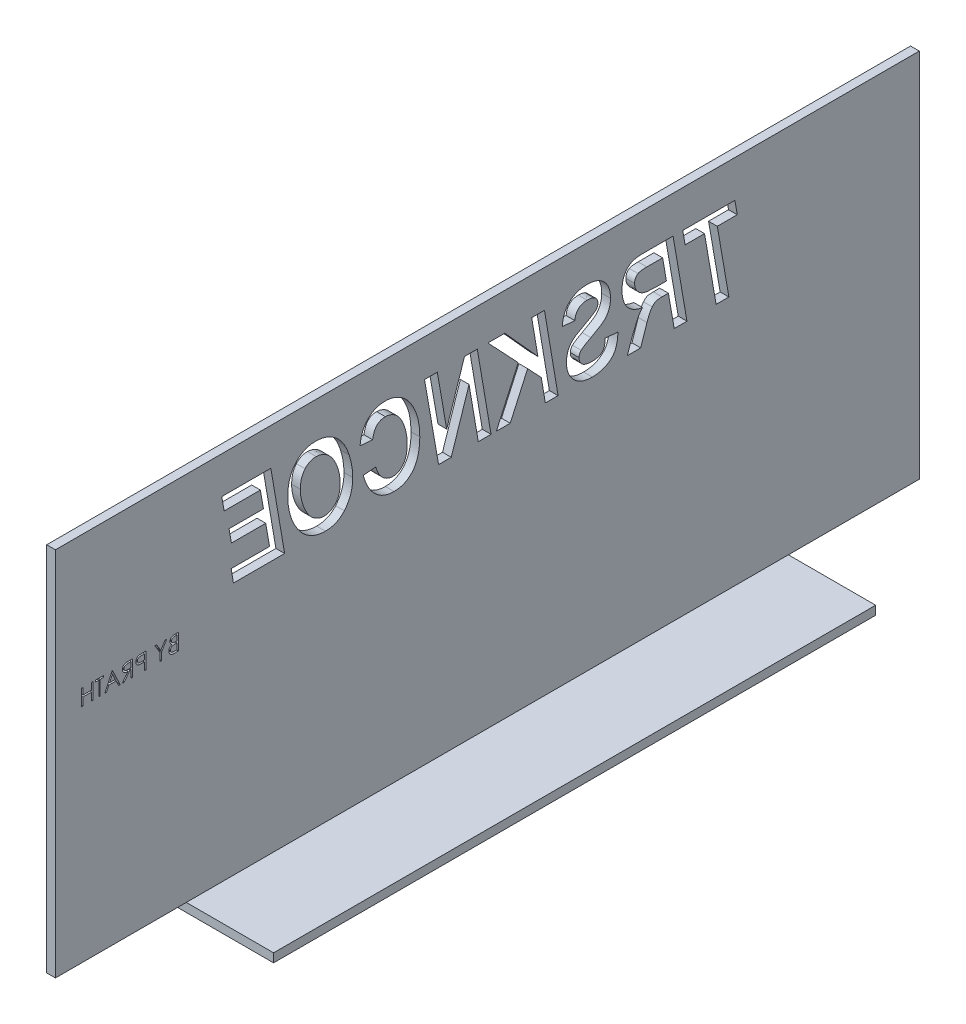
from build123d import *

# Parameters (mm, degrees)
BOSS_EXTRUDE1_DEPTH = 198
SKETCH2_W           = 22
SKETCH2_H           = 30
CUT_EXTRUDE3_DEPTH  = 2
CUT_EXTRUDE4_DEPTH  = 22


with BuildPart() as part:
    # Sketch1 → Boss-Extrude1 (new body)
    with BuildSketch(Plane.XY):
        Polygon((-48.621399177, 40.138888889), (-48.621399177, -44.861111111), (-28.621399177, -44.861111111), (-28.621399177, -46.861111111), (-50.621399177, -46.861111111), (-50.621399177, 40.138888889), align=None)
    extrude(amount=BOSS_EXTRUDE1_DEPTH)

    # Sketch2 → Cut-Extrude3 (cut)
    with BuildSketch(Plane(origin=(0, -46.861111111, 0), x_dir=(-1, 0, 0), z_dir=(0, -1, 0))):
        with Locations((39.621399177, -15)):
            Rectangle(SKETCH2_W, SKETCH2_H)
        with Locations((39.621399177, -183)):
            Rectangle(SKETCH2_W, SKETCH2_H)
    extrude(amount=-CUT_EXTRUDE3_DEPTH, mode=Mode.SUBTRACT)

    # Sketch3 → Cut-Extrude4 (cut)
    # profile 1 of 15: a face of its own
    with BuildSketch(Plane.ZY.offset(50.621399177)):
        Polygon((46.567523887, 13.138888889), (43.644393643, 13.138888889), (46.297350103, 28.508775253), (41.723157848, 28.508775253), (42.256000588, 31.63078342), (54.211190518, 31.63078342), (53.678347778, 28.508775253), (49.22423276, 28.508775253), align=None)
    # profile 2 of 15: a face of its own
    with BuildSketch(Plane.ZY.offset(50.621399177)):
        with BuildLine():
            Line((56.173702864, 13.138888889), (53.250572621, 13.138888889))
            Line((53.250572621, 13.138888889), (56.436371821, 31.63078342))
            Line((56.436371821, 31.63078342), (63.175706759, 31.63078342))
            add(Edge.make_bspline(
                [(63.175706759, 31.63078342), (63.329568599, 31.629289792), (63.627461628, 31.626397967), (64.05967934, 31.605745592), (64.46099239, 31.561928029), (64.834015106, 31.513515612), (65.174971689, 31.439375874), (65.487847202, 31.361116755), (65.768077197, 31.257486066), (66.103348884, 31.103746737), (66.485014679, 30.860869974), (66.89247786, 30.492917073), (67.253444104, 30.049007568), (67.568490048, 29.53226492), (67.831332978, 28.943034026), (68.011561018, 28.274984778), (68.119954124, 27.535454012), (68.133234947, 27.018211967), (68.140150036, 26.748893245)],
                knots=[0, 0, 0, 0, 0.919049624, 1.779378665, 2.58298458, 3.329968567, 4.02448668, 4.665989489, 5.254490669, 5.806027726, 6.867219757, 7.941194704, 9.071879607, 10.272474829, 11.54685954, 12.911757218, 14.392006979, 16, 16, 16, 16], degree=3))
            add(Edge.make_bspline(
                [(68.140150036, 26.748893245), (68.136537642, 26.548656377), (68.129456029, 26.156118873), (68.074415433, 25.582371689), (67.974591163, 25.040109892), (67.846419447, 24.526396129), (67.672159153, 24.04651755), (67.465307365, 23.594276211), (67.218139489, 23.173839662), (66.930193088, 22.786224998), (66.612325354, 22.428137368), (66.257373711, 22.107477985), (65.867730413, 21.824891536), (65.446093652, 21.577635154), (64.992069296, 21.3615867), (64.504560968, 21.183190133), (63.983970903, 21.038173694), (63.62291543, 20.975792879), (63.438375716, 20.943909308)],
                knots=[0, 0, 0, 0, 1.163404323, 2.280698027, 3.344173194, 4.364791145, 5.353309187, 6.306074943, 7.250879738, 8.181177463, 9.107634786, 10.028688646, 10.954689755, 11.899494549, 12.865009021, 13.872160013, 14.912435868, 16, 16, 16, 16], degree=3))
            add(Edge.make_bspline(
                [(63.438375716, 20.943909308), (63.545975342, 20.823344708), (63.773159455, 20.568786559), (64.078897539, 20.123598778), (64.394082408, 19.618199673), (64.582050767, 19.246974672), (64.680424638, 19.052692822)],
                knots=[0, 0, 0, 0, 0.853378181, 1.801808913, 2.849569315, 4, 4, 4, 4], degree=3))
            add(Edge.make_bspline(
                [(64.680424638, 19.052692822), (64.76637563, 18.865470321), (64.945386027, 18.475541441), (65.205959294, 17.860321923), (65.475859942, 17.195968335), (65.754905128, 16.48263916), (66.03419848, 15.717035426), (66.322973568, 14.902676433), (66.621122576, 14.039293698), (66.814033384, 13.444414097), (66.913110768, 13.138888889)],
                knots=[0, 0, 0, 0, 0.781664242, 1.627974532, 2.534890683, 3.502644135, 4.534224147, 5.627060285, 6.78127793, 8, 8, 8, 8], degree=3))
            Line((66.913110768, 13.138888889), (63.851141219, 13.138888889))
            add(Edge.make_bspline(
                [(63.851141219, 13.138888889), (63.829007535, 13.219051544), (63.776228743, 13.410203104), (63.673793891, 13.737263346), (63.541786837, 14.151053735), (63.381876956, 14.649779117), (63.183728546, 15.23249208), (62.960532937, 15.902323453), (62.70500506, 16.658120421), (62.521839138, 17.189097884), (62.425224027, 17.469174256)],
                knots=[0, 0, 0, 0, 0.437720385, 1.043764505, 1.8037744, 2.724066494, 3.800474684, 5.043444489, 6.440496257, 8, 8, 8, 8], degree=3))
            add(Edge.make_bspline(
                [(62.425224027, 17.469174256), (62.373087492, 17.614404475), (62.272526228, 17.894525399), (62.121064892, 18.296412028), (61.963982628, 18.661129509), (61.818993873, 18.994554336), (61.664799506, 19.28863695), (61.522093883, 19.551908405), (61.375438356, 19.778208339), (61.272764772, 19.912564983), (61.224451655, 19.975786583)],
                knots=[0, 0, 0, 0, 1.326924511, 2.559380028, 3.692053328, 4.741547842, 5.684376052, 6.546242998, 7.315933767, 8, 8, 8, 8], degree=3))
            add(Edge.make_bspline(
                [(61.224451655, 19.975786583), (61.156961959, 20.052040858), (61.027839637, 20.197931707), (60.821529444, 20.388708586), (60.609631386, 20.535522026), (60.387440629, 20.654268132), (60.124207794, 20.733642566), (59.801705086, 20.786617657), (59.40766413, 20.818678542), (59.120664537, 20.822023581), (58.965498629, 20.823832071)],
                knots=[0, 0, 0, 0, 0.968941115, 1.853793008, 2.666169901, 3.416897252, 4.241394675, 5.268896448, 6.523432879, 8, 8, 8, 8], degree=3))
            Line((58.965498629, 20.823832071), (57.502057301, 20.823832071))
            Line((57.502057301, 20.823832071), (56.173702864, 13.138888889))
        make_face()
        with BuildLine():
            Line((57.956099354, 23.465531289), (59.791029635, 23.465531289))
            add(Edge.make_bspline(
                [(59.791029635, 23.465531289), (59.992425568, 23.46576246), (60.377769258, 23.466204773), (60.930640589, 23.482914257), (61.432554555, 23.502738334), (61.884055779, 23.537962448), (62.285061642, 23.576249986), (62.634107427, 23.62947697), (62.933303116, 23.686793127), (63.260600485, 23.781048559), (63.624640813, 23.933268627), (64.013662689, 24.187004604), (64.371296639, 24.495753788), (64.67751844, 24.86763635), (64.937936157, 25.274662584), (65.122994249, 25.714943406), (65.236655308, 26.17655604), (65.251026235, 26.491834359), (65.258296342, 26.651330489)],
                knots=[0, 0, 0, 0, 1.341655905, 2.567075869, 3.684830852, 4.687612021, 5.583953662, 6.367664427, 7.039345834, 7.611667031, 8.634740313, 9.654141779, 10.693611133, 11.770163255, 12.852216315, 13.901559162, 14.938419889, 16, 16, 16, 16], degree=3))
            add(Edge.make_bspline(
                [(65.258296342, 26.651330489), (65.256641604, 26.737788181), (65.253458545, 26.904098332), (65.214756844, 27.144801083), (65.151157795, 27.366364836), (65.064562485, 27.570741387), (64.954491948, 27.759255047), (64.815718116, 27.926853023), (64.651369064, 28.075517768), (64.528894914, 28.158716568), (64.466537059, 28.201077332)],
                knots=[0, 0, 0, 0, 1.135910358, 2.185038931, 3.194885851, 4.160224032, 5.096688654, 6.054854728, 7.00962705, 8, 8, 8, 8], degree=3))
            add(Edge.make_bspline(
                [(64.466537059, 28.201077332), (64.423359009, 28.226080962), (64.328026299, 28.281286415), (64.159012077, 28.341508381), (63.956629365, 28.393322708), (63.721366555, 28.439537094), (63.449803142, 28.464629014), (63.146212094, 28.49369241), (62.808092626, 28.507469455), (62.57157401, 28.508326516), (62.447738509, 28.508775253)],
                knots=[0, 0, 0, 0, 0.579564179, 1.279618308, 2.077378172, 3.010695435, 4.064953319, 5.248132921, 6.559188078, 8, 8, 8, 8], degree=3))
            Line((62.447738509, 28.508775253), (58.82290691, 28.508775253))
            Line((58.82290691, 28.508775253), (57.956099354, 23.465531289))
        make_face(mode=Mode.SUBTRACT)
    # profile 3 of 15: a face of its own
    with BuildSketch(Plane.ZY.offset(50.621399177)):
        with BuildLine():
            Line((69.100767933, 18.902596275), (71.982621626, 19.14275075))
            add(Edge.make_bspline(
                [(71.982621626, 19.14275075), (71.994287599, 18.927296487), (72.015790273, 18.530172046), (72.092163388, 17.988920895), (72.18110205, 17.549707672), (72.310906676, 17.203011485), (72.486566383, 16.928577444), (72.703942056, 16.699044963), (72.964715439, 16.496943549), (73.272093823, 16.323277805), (73.633947543, 16.182739032), (74.053890772, 16.090130033), (74.531186143, 16.028444492), (74.869250874, 16.02340977), (75.048343589, 16.020742582)],
                knots=[0, 0, 0, 0, 1.520410831, 2.80241521, 3.850701541, 4.674385914, 5.396022026, 6.132219796, 6.892476354, 7.713891879, 8.61291211, 9.618221336, 10.738232148, 12, 12, 12, 12], degree=3))
            add(Edge.make_bspline(
                [(75.048343589, 16.020742582), (75.165943361, 16.023558392), (75.395174623, 16.029047106), (75.727821418, 16.052532699), (76.038547628, 16.102863427), (76.32614662, 16.168891959), (76.592421129, 16.254170005), (76.831868646, 16.365003815), (77.053648651, 16.48727039), (77.3083446, 16.681437969), (77.581742134, 16.959192755), (77.817265526, 17.35278757), (77.964734424, 17.79547941), (77.97906635, 18.107144002), (77.986483487, 18.268438366)],
                knots=[0, 0, 0, 0, 1.013540598, 1.975643205, 2.87038221, 3.722572232, 4.516630097, 5.273853093, 5.993001592, 6.693497475, 8.027261769, 9.322862643, 10.614513231, 12, 12, 12, 12], degree=3))
            add(Edge.make_bspline(
                [(77.986483487, 18.268438366), (77.980924699, 18.382886523), (77.969991362, 18.60798961), (77.876763151, 18.932682135), (77.721409213, 19.232407182), (77.573721328, 19.401860495), (77.498669711, 19.487972807)],
                knots=[0, 0, 0, 0, 1.018283683, 2.002817762, 2.985077502, 4, 4, 4, 4], degree=3))
            add(Edge.make_bspline(
                [(77.498669711, 19.487972807), (77.451794443, 19.532500916), (77.349371068, 19.629795703), (77.167209423, 19.770809897), (76.948201845, 19.924239304), (76.691855559, 20.093421164), (76.397130009, 20.278045974), (76.058021529, 20.465381816), (75.685679304, 20.674750168), (75.422651785, 20.8144028), (75.28474565, 20.887623103)],
                knots=[0, 0, 0, 0, 0.590480477, 1.290211368, 2.102035284, 3.034021357, 4.096544472, 5.278887346, 6.573312291, 8, 8, 8, 8], degree=3))
            add(Edge.make_bspline(
                [(75.28474565, 20.887623103), (75.109331982, 20.980876723), (74.772256198, 21.160073347), (74.293520578, 21.425968892), (73.859427622, 21.67486472), (73.469491482, 21.906139883), (73.123922713, 22.123511097), (72.822884324, 22.325316465), (72.56812018, 22.512684261), (72.286855412, 22.73605222), (71.985637141, 23.026780966), (71.679233733, 23.413945659), (71.405237536, 23.831037047), (71.180453416, 24.288961278), (70.99966633, 24.780190513), (70.872466182, 25.306390749), (70.796952422, 25.864872936), (70.786968452, 26.248332171), (70.781849254, 26.444947738)],
                knots=[0, 0, 0, 0, 1.246546927, 2.395370823, 3.436045129, 4.3863436, 5.23993239, 5.997476255, 6.659929147, 7.22377446, 8.250624136, 9.277803704, 10.316226236, 11.376254308, 12.471269764, 13.594389891, 14.766543215, 16, 16, 16, 16], degree=3))
            add(Edge.make_bspline(
                [(70.781849254, 26.444947738), (70.785923916, 26.646526649), (70.793869655, 27.039612913), (70.862987197, 27.613397311), (70.974788204, 28.156057143), (71.131330228, 28.668317859), (71.336400935, 29.147329983), (71.580060077, 29.598559864), (71.87422008, 30.016006771), (72.2128072, 30.398294567), (72.587473139, 30.744583153), (72.999186704, 31.046470047), (73.444820218, 31.30278229), (73.922664225, 31.513183989), (74.433322053, 31.67601402), (74.977213356, 31.784809124), (75.551574481, 31.860121223), (75.946164932, 31.867279839), (76.147800792, 31.870937895)],
                knots=[0, 0, 0, 0, 1.121247003, 2.186472748, 3.210148776, 4.200738383, 5.161165769, 6.104830393, 7.04898248, 7.995670446, 8.941334633, 9.882300828, 10.830113673, 11.796072362, 12.782104355, 13.805780383, 14.878752997, 16, 16, 16, 16], degree=3))
            add(Edge.make_bspline(
                [(76.147800792, 31.870937895), (76.351876182, 31.866820905), (76.751182926, 31.858765343), (77.334919704, 31.789719846), (77.887657569, 31.678418507), (78.410287564, 31.521369374), (78.89798677, 31.313296774), (79.357914913, 31.065526541), (79.781633132, 30.766040214), (80.17713861, 30.429084905), (80.534804822, 30.050171286), (80.846860967, 29.628625257), (81.122961548, 29.174193879), (81.352189625, 28.679330921), (81.534617909, 28.147969056), (81.677590517, 27.580697602), (81.779199548, 26.97699665), (81.812123367, 26.560375215), (81.828955078, 26.347384983)],
                knots=[0, 0, 0, 0, 1.101317662, 2.154907414, 3.167906546, 4.141877806, 5.094959521, 6.025581883, 6.956522612, 7.890274933, 8.826489602, 9.762314628, 10.716471989, 11.692173592, 12.700051806, 13.744842569, 14.847091228, 16, 16, 16, 16], degree=3))
            Line((81.828955078, 26.347384983), (78.947101385, 26.107230508))
            add(Edge.make_bspline(
                [(78.947101385, 26.107230508), (78.922579595, 26.314906404), (78.876029567, 26.709140215), (78.704888717, 27.253696326), (78.46509659, 27.719954176), (78.142594897, 28.102210955), (77.74205921, 28.396828866), (77.269322607, 28.603800486), (76.725813308, 28.728875296), (76.339891873, 28.742009238), (76.136543551, 28.748929727)],
                knots=[0, 0, 0, 0, 1.155090298, 2.192722699, 3.140166295, 4.038822298, 4.934487934, 5.867075245, 6.876127035, 8, 8, 8, 8], degree=3))
            add(Edge.make_bspline(
                [(76.136543551, 28.748929727), (75.937235822, 28.744380915), (75.564813652, 28.735881103), (75.046635068, 28.643395544), (74.610420584, 28.489354377), (74.256775794, 28.267818795), (73.988497648, 27.988738064), (73.798972556, 27.661606581), (73.682705429, 27.289430731), (73.670193748, 27.024943197), (73.663702947, 26.88773255)],
                knots=[0, 0, 0, 0, 1.360316716, 2.541858782, 3.579953702, 4.502023153, 5.36621562, 6.197157373, 7.064722641, 8, 8, 8, 8], degree=3))
            add(Edge.make_bspline(
                [(73.663702947, 26.88773255), (73.670910388, 26.760217804), (73.68491821, 26.512390044), (73.817175279, 26.161067634), (74.031807725, 25.849345464), (74.227181743, 25.68523792), (74.327880166, 25.600654664)],
                knots=[0, 0, 0, 0, 1.014279531, 1.971274952, 2.954367562, 4, 4, 4, 4], degree=3))
            add(Edge.make_bspline(
                [(74.327880166, 25.600654664), (74.386236973, 25.556272411), (74.511988226, 25.460634486), (74.722171643, 25.321492045), (74.959416079, 25.16498432), (75.231361693, 25.001335563), (75.531716645, 24.821819003), (75.865816804, 24.634046563), (76.22692857, 24.430915468), (76.481432355, 24.296705101), (76.613100087, 24.227271263)],
                knots=[0, 0, 0, 0, 0.659164579, 1.420413089, 2.265921517, 3.215069028, 4.274159563, 5.412647679, 6.661431262, 8, 8, 8, 8], degree=3))
            add(Edge.make_bspline(
                [(76.613100087, 24.227271263), (76.786281615, 24.137013391), (77.11838684, 23.963928471), (77.586066347, 23.698835379), (78.01160059, 23.456222355), (78.39095459, 23.22762731), (78.723533891, 23.014555119), (79.012332617, 22.819845868), (79.251120894, 22.6374997), (79.509078992, 22.415952803), (79.783793087, 22.131531854), (80.067369865, 21.757437968), (80.306751586, 21.345181622), (80.510671952, 20.900846219), (80.671637582, 20.42302256), (80.788642697, 19.912977809), (80.855707462, 19.372200877), (80.864070825, 19.00159398), (80.86833718, 18.812538347)],
                knots=[0, 0, 0, 0, 1.270262823, 2.435946395, 3.496632551, 4.456673833, 5.316608941, 6.065876655, 6.72171307, 7.269767235, 8.276759071, 9.287327571, 10.315785927, 11.371655164, 12.462617561, 13.589636757, 14.770414822, 16, 16, 16, 16], degree=3))
            add(Edge.make_bspline(
                [(80.86833718, 18.812538347), (80.863133288, 18.599696268), (80.852936974, 18.182661391), (80.777659077, 17.571823761), (80.649013377, 16.992015352), (80.475033581, 16.439198058), (80.238395848, 15.921474674), (79.961278853, 15.428738402), (79.628185491, 14.968847857), (79.246644403, 14.543161297), (78.824780688, 14.157635023), (78.366749497, 13.82082131), (77.877754759, 13.534807975), (77.354903892, 13.299573251), (76.798271088, 13.120439783), (76.208577216, 12.994359235), (75.588461261, 12.912811944), (75.163680049, 12.903489269), (74.94702842, 12.898734414)],
                knots=[0, 0, 0, 0, 1.085260672, 2.126419521, 3.132360815, 4.110683442, 5.075669868, 6.029801971, 6.989291782, 7.96501179, 8.940273018, 9.898362516, 10.858869454, 11.82385588, 12.816278689, 13.834680673, 14.895619805, 16, 16, 16, 16], degree=3))
            add(Edge.make_bspline(
                [(74.94702842, 12.898734414), (74.781807926, 12.900046985), (74.45831797, 12.902616904), (73.982629374, 12.947840617), (73.524885469, 13.00906302), (73.084851743, 13.099424259), (72.663448289, 13.215514256), (72.260781602, 13.35823361), (71.876788982, 13.527259108), (71.513345514, 13.722297994), (71.173605249, 13.938412105), (70.861093637, 14.172861114), (70.571909066, 14.419324694), (70.318480325, 14.691970214), (70.087639248, 14.976233039), (69.887872011, 15.279700832), (69.713339225, 15.598802271), (69.526935527, 16.050849905), (69.343333941, 16.640854591), (69.191176401, 17.372273609), (69.099723195, 18.12974211), (69.100415897, 18.642174066), (69.100767933, 18.902596275)],
                knots=[0, 0, 0, 0, 1.033089426, 2.022715487, 2.986516948, 3.921035096, 4.830318251, 5.718759763, 6.591067943, 7.45221577, 8.296564001, 9.107174858, 9.894763495, 10.669657106, 11.432166275, 12.183024751, 12.93924541, 13.703639053, 15.237902801, 16.797024157, 18.372220865, 20, 20, 20, 20], degree=3))
        make_face()
    # profile 4 of 15: a face of its own
    with BuildSketch(Plane.ZY.offset(50.621399177)):
        Polygon((82.789572976, 13.138888889), (85.911581143, 31.63078342), (88.838463801, 31.63078342), (87.416299022, 23.229129229), (95.007431863, 31.63078342), (98.879922763, 31.63078342), (91.926700245, 24.261042986), (96.939924899, 13.138888889), (93.757878113, 13.138888889), (89.769062389, 21.979575479), (86.643301808, 18.662441801), (85.712703219, 13.138888889), align=None)
    # profile 5 of 15: a face of its own
    with BuildSketch(Plane.ZY.offset(50.621399177)):
        Polygon((110.178440302, 13.138888889), (107.277824541, 13.138888889), (103.195198475, 25.563130527), (101.078837169, 13.138888889), (98.159459339, 13.138888889), (101.311486816, 31.63078342), (104.238369474, 31.63078342), (108.320995539, 19.25532316), (110.474880981, 31.63078342), (113.405516052, 31.63078342), align=None)
    # profile 6 of 15: a face of its own
    with BuildSketch(Plane.ZY.offset(50.621399177)):
        with BuildLine():
            Line((124.576451527, 19.863214173), (127.45830522, 19.623059699))
            add(Edge.make_bspline(
                [(127.45830522, 19.623059699), (127.377106464, 19.350809264), (127.218320396, 18.818417175), (126.942123434, 18.05292135), (126.633146306, 17.34205914), (126.300634067, 16.682160847), (125.935656806, 16.077207727), (125.545775615, 15.521894808), (125.12442503, 15.021644817), (124.677335596, 14.573576547), (124.207157952, 14.178903218), (123.719135256, 13.834338678), (123.2082518, 13.548989068), (122.681866247, 13.310215436), (122.136062706, 13.126399704), (121.572120798, 12.994230843), (120.990233629, 12.913627685), (120.595394894, 12.90372747), (120.396262706, 12.898734414)],
                knots=[0, 0, 0, 0, 1.293727053, 2.529913503, 3.703523175, 4.821930671, 5.89266624, 6.918437208, 7.908929347, 8.867606484, 9.797555239, 10.701510419, 11.584031482, 12.458574122, 13.330459673, 14.202345223, 15.093374342, 16, 16, 16, 16], degree=3))
            add(Edge.make_bspline(
                [(120.396262706, 12.898734414), (120.174484086, 12.903776192), (119.741340822, 12.913623003), (119.110381694, 13.011724676), (118.513569852, 13.162108174), (117.955364277, 13.38416485), (117.42683794, 13.65742294), (116.938376248, 14.002050534), (116.485792781, 14.407798382), (116.066166442, 14.869892811), (115.694843273, 15.398610652), (115.370540478, 15.988798553), (115.097471885, 16.642104429), (114.873499612, 17.355621953), (114.702106498, 18.130511981), (114.580306132, 18.965727429), (114.504692877, 19.863078342), (114.494973258, 20.482207767), (114.489963601, 20.801317589)],
                knots=[0, 0, 0, 0, 0.952434383, 1.860145653, 2.737604016, 3.592088319, 4.436058528, 5.28907053, 6.153322799, 7.043937438, 7.965658913, 8.923221959, 9.932585217, 11.003645484, 12.133024564, 13.339497442, 14.628731794, 16, 16, 16, 16], degree=3))
            add(Edge.make_bspline(
                [(114.489963601, 20.801317589), (114.493793781, 21.080326707), (114.501340762, 21.630085824), (114.554244784, 22.441617418), (114.643184359, 23.227053255), (114.77239313, 23.986783927), (114.931386397, 24.722913213), (115.131856757, 25.432527655), (115.362856171, 26.117770301), (115.633860127, 26.771411885), (115.929467785, 27.393883769), (116.246517061, 27.978411833), (116.586548979, 28.521101616), (116.940867395, 29.024415367), (117.317401998, 29.485643713), (117.717378081, 29.902089974), (118.131748796, 30.283504328), (118.570374257, 30.616852404), (119.019558131, 30.914399821), (119.481666452, 31.169623451), (119.953511143, 31.385130975), (120.433217672, 31.560103954), (120.92129446, 31.703000164), (121.420347742, 31.797377189), (121.928086852, 31.86138246), (122.269769523, 31.867743847), (122.441328153, 31.870937895)],
                knots=[0, 0, 0, 0, 1.326081857, 2.612909553, 3.863592758, 5.081387437, 6.274331785, 7.441291427, 8.584352171, 9.709351928, 10.802289631, 11.858454482, 12.867995201, 13.844524669, 14.782338058, 15.694803285, 16.586998335, 17.456218336, 18.310343858, 19.145894667, 19.962643095, 20.773288765, 21.571123956, 22.37678395, 23.184984359, 24, 24, 24, 24], degree=3))
            add(Edge.make_bspline(
                [(122.441328153, 31.870937895), (122.633001589, 31.867556863), (123.00914544, 31.860921858), (123.559933502, 31.780701918), (124.089062577, 31.664004711), (124.591236014, 31.489907471), (125.069169369, 31.27059886), (125.52289961, 31.002832014), (125.949746729, 30.682228841), (126.352506919, 30.317424013), (126.724160659, 29.9094089), (127.056826028, 29.455732718), (127.344512192, 28.958910184), (127.593566929, 28.4210887), (127.803371635, 27.842429327), (127.971265385, 27.22099235), (128.099143286, 26.558545937), (128.151784123, 26.101410724), (128.178768643, 25.867076034)],
                knots=[0, 0, 0, 0, 0.996424594, 1.955403901, 2.889960847, 3.811926292, 4.71458142, 5.621939309, 6.547320429, 7.487164165, 8.445392458, 9.413775902, 10.408243551, 11.427256147, 12.493625461, 13.606592377, 14.77310166, 16, 16, 16, 16], degree=3))
            Line((128.178768643, 25.867076034), (125.29691495, 25.626921559))
            add(Edge.make_bspline(
                [(125.29691495, 25.626921559), (125.273433228, 25.764805546), (125.228148124, 26.030718358), (125.137632877, 26.41162901), (125.032503818, 26.759490777), (124.918345781, 27.078810111), (124.781330069, 27.363095541), (124.636763641, 27.622203249), (124.471663912, 27.846643251), (124.235622845, 28.10335923), (123.899838332, 28.365476485), (123.438949367, 28.591392604), (122.921505154, 28.724826981), (122.558454455, 28.740694523), (122.370032293, 28.748929727)],
                knots=[0, 0, 0, 0, 1.059068388, 2.042440618, 2.962453515, 3.810607956, 4.60720763, 5.349764878, 6.054566734, 6.711530681, 7.986817897, 9.253492024, 10.574571061, 12, 12, 12, 12], degree=3))
            add(Edge.make_bspline(
                [(122.370032293, 28.748929727), (122.170044531, 28.739089523), (121.767309243, 28.719273324), (121.173827312, 28.546757856), (120.593959113, 28.276184878), (120.129970649, 27.968055004), (119.768618729, 27.669100395), (119.505614293, 27.40053064), (119.256362315, 27.095887544), (119.012915248, 26.758457576), (118.782762956, 26.383884646), (118.560073899, 25.973433298), (118.352519263, 25.525705344), (118.149403952, 25.049153972), (117.967319554, 24.546995912), (117.81032942, 24.027920036), (117.675268616, 23.498283626), (117.561493304, 22.956553335), (117.475201792, 22.400400015), (117.417403873, 21.831664526), (117.376955769, 21.250939674), (117.373543607, 20.860176746), (117.371817294, 20.662478283)],
                knots=[0, 0, 0, 0, 1.145465754, 2.306738557, 3.517194819, 4.806975745, 5.489679443, 6.205201462, 6.95957962, 7.746273907, 8.590655508, 9.480126617, 10.423955707, 11.420936108, 12.451596229, 13.486793541, 14.531129386, 15.586722266, 16.66158163, 17.758424421, 18.865920958, 20, 20, 20, 20], degree=3))
            add(Edge.make_bspline(
                [(117.371817294, 20.662478283), (117.374426495, 20.480993905), (117.379509439, 20.127447009), (117.426544428, 19.615186202), (117.494270045, 19.133902018), (117.601863644, 18.687087076), (117.730129478, 18.268833606), (117.893175782, 17.885417066), (118.078932308, 17.531377128), (118.302827025, 17.218565845), (118.541637739, 16.936282965), (118.796262225, 16.691294228), (119.066514665, 16.48603864), (119.347083534, 16.317402074), (119.639711721, 16.182783552), (119.945166554, 16.089789969), (120.263916521, 16.030931885), (120.481057203, 16.024175539), (120.591388217, 16.020742582)],
                knots=[0, 0, 0, 0, 1.380890055, 2.690090442, 3.9125549, 5.076342896, 6.184321693, 7.238094847, 8.243274922, 9.22047705, 10.159078855, 11.054594157, 11.903775791, 12.736414565, 13.54160829, 14.34860083, 15.160910137, 16, 16, 16, 16], degree=3))
            add(Edge.make_bspline(
                [(120.591388217, 16.020742582), (120.696604477, 16.023655504), (120.906746477, 16.029473304), (121.21861273, 16.075621206), (121.523130093, 16.151967576), (121.823595027, 16.252448707), (122.114387304, 16.389774787), (122.403624019, 16.55121028), (122.682328058, 16.748009278), (122.959347647, 16.968428506), (123.219274189, 17.224598584), (123.470055427, 17.506408169), (123.699252729, 17.823618389), (123.906542344, 18.173723495), (124.104961939, 18.5502368), (124.278243634, 18.960873243), (124.441896972, 19.399423068), (124.530903105, 19.706215008), (124.576451527, 19.863214173)],
                knots=[0, 0, 0, 0, 0.846341629, 1.69034637, 2.530019767, 3.370235803, 4.234810972, 5.113619983, 6.032102741, 6.976734475, 7.958899061, 8.964351669, 10.009128465, 11.101673558, 12.236017666, 13.43063847, 14.685142717, 16, 16, 16, 16], degree=3))
        make_face()
    # profile 7 of 15: a face of its own
    with BuildSketch(Plane.ZY.offset(50.621399177)):
        with BuildLine():
            add(Edge.make_bspline(
                [(129.859849964, 20.414818981), (129.870729131, 20.814278277), (129.892697353, 21.620903513), (130.049354327, 22.838174868), (130.302254651, 24.073310479), (130.54880284, 24.889396161), (130.674123729, 25.304213984)],
                knots=[0, 0, 0, 0, 0.963193428, 1.944969454, 2.955424269, 4, 4, 4, 4], degree=3))
            add(Edge.make_bspline(
                [(130.674123729, 25.304213984), (130.762162533, 25.566844161), (130.934172668, 26.079970762), (131.242173037, 26.81409691), (131.572252245, 27.502592903), (131.943306526, 28.138838572), (132.339982651, 28.729517171), (132.767410593, 29.27180478), (133.228818171, 29.763165682), (133.718500407, 30.204896001), (134.235313721, 30.596355071), (134.770681345, 30.939951428), (135.331177199, 31.225541569), (135.90751373, 31.46366569), (136.506441095, 31.643555144), (137.122394419, 31.775138505), (137.760267198, 31.856382858), (138.192470893, 31.866041106), (138.411600702, 31.870937895)],
                knots=[0, 0, 0, 0, 1.216551129, 2.37689649, 3.495150927, 4.568696903, 5.609681947, 6.618955889, 7.598654045, 8.567519454, 9.512719647, 10.44416167, 11.358424487, 12.272769875, 13.18020306, 14.101720153, 15.037560982, 16, 16, 16, 16], degree=3))
            add(Edge.make_bspline(
                [(138.411600702, 31.870937895), (138.637032042, 31.863951348), (139.079867502, 31.850227033), (139.728667728, 31.756986753), (140.345565923, 31.592753668), (140.934466196, 31.369871605), (141.488350411, 31.070870478), (142.018335844, 30.719523079), (142.510647314, 30.293626396), (142.971480549, 29.810575564), (143.390615035, 29.272379379), (143.757168385, 28.68280816), (144.064550303, 28.04572525), (144.316836789, 27.362169358), (144.511187379, 26.632056696), (144.647333795, 25.854851894), (144.737402601, 25.032404355), (144.745355088, 24.467675129), (144.749427379, 24.178489885)],
                knots=[0, 0, 0, 0, 0.966414374, 1.898416407, 2.802368553, 3.698621911, 4.590968747, 5.49520713, 6.419401808, 7.375180386, 8.353408959, 9.338447904, 10.34571291, 11.380644929, 12.457647232, 13.579951275, 14.760747014, 16, 16, 16, 16], degree=3))
            add(Edge.make_bspline(
                [(144.749427379, 24.178489885), (144.746109023, 23.911961154), (144.739526, 23.38321593), (144.678203101, 22.598933276), (144.575525182, 21.830295025), (144.43868879, 21.076822962), (144.257864141, 20.338873576), (144.035159165, 19.618024829), (143.777136968, 18.910507334), (143.47754535, 18.225140804), (143.151035557, 17.569819341), (142.800151557, 16.955563742), (142.433693981, 16.384301202), (142.046898068, 15.857490859), (141.640140513, 15.37418513), (141.214178427, 14.935993341), (140.767734538, 14.541847484), (140.303323252, 14.193218758), (139.821669051, 13.888902337), (139.327955159, 13.626234838), (138.825711469, 13.398093918), (138.307261301, 13.219145269), (137.778578533, 13.074772603), (137.236139927, 12.975835972), (136.683494976, 12.907225707), (136.310461466, 12.901578131), (136.122628368, 12.898734414)],
                knots=[0, 0, 0, 0, 1.217132172, 2.414572046, 3.590117927, 4.757655198, 5.910424493, 7.05787345, 8.201904405, 9.348087043, 10.472190257, 11.544254622, 12.577409689, 13.570312385, 14.527042546, 15.460236935, 16.358778897, 17.244241479, 18.109573045, 18.958071612, 19.796802434, 20.626083403, 21.460308086, 22.297266659, 23.142624804, 24, 24, 24, 24], degree=3))
            add(Edge.make_bspline(
                [(136.122628368, 12.898734414), (135.900958184, 12.90459121), (135.467143169, 12.916053128), (134.834411615, 13.002951046), (134.236449829, 13.148840164), (133.674574993, 13.357031195), (133.144491572, 13.620145287), (132.650541345, 13.946228356), (132.188902057, 14.328475501), (131.917853193, 14.625212129), (131.78108576, 14.774941246)],
                knots=[0, 0, 0, 0, 1.088219545, 2.129677386, 3.129217206, 4.104710543, 5.066064136, 6.028535389, 7.005226766, 8, 8, 8, 8], degree=3))
            add(Edge.make_bspline(
                [(131.78108576, 14.774941246), (131.627151876, 14.963454755), (131.320816456, 15.338605196), (130.92928325, 15.952945512), (130.598283148, 16.60419652), (130.327525711, 17.294220007), (130.11718148, 18.021628573), (129.968386106, 18.78634764), (129.876179257, 19.588276651), (129.865365531, 20.135636713), (129.859849964, 20.414818981)],
                knots=[0, 0, 0, 0, 0.958413797, 1.907286972, 2.863975495, 3.83327813, 4.823803275, 5.84362205, 6.900134428, 8, 8, 8, 8], degree=3))
        make_face()
        with BuildLine():
            add(Edge.make_bspline(
                [(132.741703658, 20.482362427), (132.743772975, 20.317089339), (132.747828795, 19.993157561), (132.803257383, 19.521819961), (132.884259346, 19.074700685), (133.000273381, 18.653692006), (133.150406775, 18.25758267), (133.33497442, 17.887841994), (133.553223876, 17.543964805), (133.80540218, 17.231220693), (134.075745362, 16.946066359), (134.368579503, 16.701402274), (134.671226567, 16.488022967), (134.994491066, 16.319988356), (135.327541223, 16.182434748), (135.678223112, 16.088928053), (136.04189653, 16.031300215), (136.29002069, 16.02428505), (136.415316634, 16.020742582)],
                knots=[0, 0, 0, 0, 1.226484536, 2.403883905, 3.518667801, 4.597952776, 5.641481793, 6.659064971, 7.661274628, 8.659171831, 9.637868518, 10.573721042, 11.488271211, 12.381493812, 13.273121672, 14.158536699, 15.070111178, 16, 16, 16, 16], degree=3))
            add(Edge.make_bspline(
                [(136.415316634, 16.020742582), (136.622813026, 16.031743734), (137.042085463, 16.05397294), (137.665627844, 16.234274126), (138.279375929, 16.525887849), (138.780937762, 16.848881522), (139.170764231, 17.169021928), (139.458486776, 17.451025058), (139.738927505, 17.769021722), (140.005370953, 18.124810087), (140.267938027, 18.513680806), (140.512869277, 18.941597676), (140.749683534, 19.405428872), (141.05231115, 20.06590637), (141.381257935, 20.921239455), (141.656965296, 21.974758713), (141.83533019, 23.03418894), (141.85684079, 23.745016016), (141.867573686, 24.099689199)],
                knots=[0, 0, 0, 0, 0.93285394, 1.884948168, 2.897567125, 3.984534091, 4.560547829, 5.165761399, 5.796069181, 6.467226349, 7.165264902, 7.906946058, 8.685047859, 9.508902911, 11.176825677, 12.802034936, 14.404348283, 16, 16, 16, 16], degree=3))
            add(Edge.make_bspline(
                [(141.867573686, 24.099689199), (141.863416914, 24.281138727), (141.855317409, 24.634694587), (141.808503765, 25.150744933), (141.720551995, 25.63707914), (141.603963683, 26.095641868), (141.443543104, 26.521209603), (141.255884982, 26.919574192), (141.032971779, 27.288996372), (140.853296041, 27.510043926), (140.764364069, 27.619453214)],
                knots=[0, 0, 0, 0, 1.155793709, 2.252073308, 3.2959265, 4.300685875, 5.261041121, 6.187493099, 7.102884933, 8, 8, 8, 8], degree=3))
            add(Edge.make_bspline(
                [(140.764364069, 27.619453214), (140.682570592, 27.710256029), (140.52171122, 27.888833637), (140.248919432, 28.119022056), (139.956272906, 28.310722708), (139.647856262, 28.475440243), (139.316786773, 28.598022247), (138.966792744, 28.684482352), (138.599595323, 28.737681609), (138.34798774, 28.745141685), (138.220227606, 28.748929727)],
                knots=[0, 0, 0, 0, 1.018392093, 2.002823658, 2.966304501, 3.932210761, 4.912654514, 5.901938241, 6.934655907, 8, 8, 8, 8], degree=3))
            add(Edge.make_bspline(
                [(138.220227606, 28.748929727), (138.008927807, 28.73817151), (137.580626679, 28.716364785), (136.944025065, 28.531107875), (136.314507534, 28.23819659), (135.804077383, 27.906050123), (135.40609143, 27.583202312), (135.113335345, 27.299958869), (134.831209979, 26.984831582), (134.564235088, 26.631720542), (134.306219451, 26.245819952), (134.057931179, 25.825612648), (133.826390881, 25.367710522), (133.602915949, 24.883329253), (133.400387921, 24.373793557), (133.225787272, 23.849655871), (133.073096875, 23.315761745), (132.955891203, 22.769736812), (132.85573038, 22.214631229), (132.788819928, 21.647000886), (132.752151974, 21.068228704), (132.745206702, 20.678787922), (132.741703658, 20.482362427)],
                knots=[0, 0, 0, 0, 1.162226331, 2.355813174, 3.622972335, 4.97805801, 5.698018829, 6.443638077, 7.219588473, 8.025818431, 8.880086437, 9.775864783, 10.71270804, 11.705552786, 12.713843633, 13.731438913, 14.747983814, 15.771162905, 16.806589168, 17.85443666, 18.917824325, 20, 20, 20, 20], degree=3))
        make_face(mode=Mode.SUBTRACT)
    # profile 8 of 15: a face of its own
    with BuildSketch(Plane.ZY.offset(50.621399177)):
        Polygon((145.469890803, 13.138888889), (148.629423107, 31.63078342), (159.871654441, 31.63078342), (159.335059287, 28.508775253), (151.023463024, 28.508775253), (150.325514082, 24.426149187), (158.205582775, 24.426149187), (157.668987621, 21.30414102), (149.796423756, 21.30414102), (148.925863786, 16.260897057), (157.717768999, 16.260897057), (157.199935913, 13.138888889), align=None)
    # profile 9 of 15: a face of its own
    with BuildSketch(Plane.ZY.offset(50.621399177)):
        with BuildLine():
            Line((169.830315171, 9.669444444), (170.553043202, 9.669444444))
            add(Edge.make_bspline(
                [(170.553043202, 9.669444444), (170.588421675, 9.669258442), (170.65699396, 9.668897923), (170.756709536, 9.663306609), (170.850106194, 9.655682725), (170.93721102, 9.643585877), (171.017983763, 9.62898958), (171.092667846, 9.611313491), (171.161025778, 9.590118658), (171.242636758, 9.556414677), (171.335686124, 9.506330991), (171.436437756, 9.432323259), (171.522590576, 9.341801402), (171.596871095, 9.239690592), (171.65592728, 9.127363567), (171.698651453, 9.007497592), (171.725700204, 8.881638749), (171.728481964, 8.795233052), (171.729887821, 8.751565004)],
                knots=[0, 0, 0, 0, 1.001505555, 1.941167018, 2.826882275, 3.653841531, 4.429895133, 5.150066043, 5.825578002, 6.45369114, 7.647487171, 8.808567382, 9.977351308, 11.170798116, 12.373658725, 13.556498008, 14.765093433, 16, 16, 16, 16], degree=3))
            add(Edge.make_bspline(
                [(171.729887821, 8.751565004), (171.728730831, 8.710657716), (171.726457237, 8.630271037), (171.704716151, 8.512696438), (171.670679443, 8.400776398), (171.623366388, 8.294919374), (171.561875108, 8.197517133), (171.489000054, 8.107783943), (171.401077105, 8.029519074), (171.33520301, 7.985764503), (171.301741954, 7.963539163)],
                knots=[0, 0, 0, 0, 1.044552857, 2.05264487, 3.044412934, 4.028983338, 5.005914585, 5.980388656, 6.974128949, 8, 8, 8, 8], degree=3))
            add(Edge.make_bspline(
                [(171.301741954, 7.963539163), (171.34382174, 7.947383705), (171.424330794, 7.916474314), (171.53512349, 7.861826781), (171.630579701, 7.802388548), (171.711433348, 7.737479006), (171.780582366, 7.667513848), (171.840963396, 7.591467186), (171.892484517, 7.508347), (171.936630694, 7.419019925), (171.971078127, 7.324398079), (171.99687596, 7.225369008), (172.011658177, 7.122287812), (172.013761764, 7.052135786), (172.014823718, 7.01672092)],
                knots=[0, 0, 0, 0, 1.27268992, 2.434971085, 3.483601985, 4.442670788, 5.356604649, 6.2567628, 7.179492994, 8.113709626, 9.066344395, 10.018646069, 10.999752585, 12, 12, 12, 12], degree=3))
            add(Edge.make_bspline(
                [(172.014823718, 7.01672092), (172.013789889, 6.98056098), (172.011755802, 6.909415286), (171.996748665, 6.804899435), (171.971339027, 6.705019284), (171.936338731, 6.609128799), (171.890658614, 6.51741349), (171.835066519, 6.429769452), (171.768781447, 6.347077285), (171.694631578, 6.268418118), (171.610745807, 6.197692043), (171.520241633, 6.134704586), (171.421979278, 6.082903337), (171.317572584, 6.039388881), (171.20585035, 6.006149596), (171.087314257, 5.982895289), (170.962066537, 5.967226625), (170.876119551, 5.965938416), (170.832042935, 5.965277778)],
                knots=[0, 0, 0, 0, 0.978564426, 1.925352924, 2.850884081, 3.763762016, 4.682927383, 5.618979971, 6.567305752, 7.547517671, 8.540179244, 9.531824382, 10.526200242, 11.540722885, 12.589160233, 13.674978461, 14.80764778, 16, 16, 16, 16], degree=3))
            Line((170.832042935, 5.965277778), (169.830315171, 5.965277778))
            Line((169.830315171, 5.965277778), (169.830315171, 9.669444444))
        make_face()
        with BuildLine():
            Line((170.162740385, 9.289529915), (170.162740385, 8.102297009))
            Line((170.162740385, 8.102297009), (170.386088575, 8.102297009))
            add(Edge.make_bspline(
                [(170.386088575, 8.102297009), (170.418736883, 8.10272026), (170.481820069, 8.103538069), (170.573175293, 8.105880708), (170.65797427, 8.112440304), (170.736070627, 8.118998015), (170.80734138, 8.129660287), (170.871628633, 8.14235195), (170.929941315, 8.155774691), (170.997187334, 8.178602398), (171.073464538, 8.212339605), (171.154779573, 8.264697298), (171.22646522, 8.327058905), (171.286998911, 8.399016006), (171.33654105, 8.478249386), (171.370951399, 8.563494835), (171.394284774, 8.652627808), (171.396392479, 8.713818792), (171.397462607, 8.744886819)],
                knots=[0, 0, 0, 0, 1.156816544, 2.235205308, 3.236616184, 4.169592532, 5.011045266, 5.787822928, 6.49130361, 7.128639758, 8.301311294, 9.436451833, 10.541879658, 11.654887649, 12.756523258, 13.837046038, 14.901820046, 16, 16, 16, 16], degree=3))
            add(Edge.make_bspline(
                [(171.397462607, 8.744886819), (171.396905733, 8.76544576), (171.395813364, 8.805774369), (171.386866952, 8.864564102), (171.371661269, 8.919855407), (171.352130475, 8.972406007), (171.324837446, 9.020572715), (171.292702781, 9.066020931), (171.253877092, 9.107202923), (171.209683936, 9.145693975), (171.15887481, 9.179819434), (171.101480026, 9.209707575), (171.036723068, 9.233774897), (170.965695297, 9.254852825), (170.887303396, 9.269657103), (170.802451993, 9.281990271), (170.710446082, 9.28826909), (170.646792515, 9.289100265), (170.613888889, 9.289529915)],
                knots=[0, 0, 0, 0, 0.91205012, 1.789085906, 2.630437955, 3.453916878, 4.269457761, 5.079663411, 5.91843418, 6.774407191, 7.675494373, 8.627863946, 9.638891023, 10.736472738, 11.911756761, 13.175263542, 14.539845004, 16, 16, 16, 16], degree=3))
            Line((170.613888889, 9.289529915), (170.162740385, 9.289529915))
        make_face(mode=Mode.SUBTRACT)
        with BuildLine():
            Line((170.162740385, 7.722382479), (170.162740385, 6.345192308))
            Line((170.162740385, 6.345192308), (170.636149506, 6.345192308))
            add(Edge.make_bspline(
                [(170.636149506, 6.345192308), (170.670036202, 6.34559844), (170.735348343, 6.346381208), (170.829647145, 6.348936611), (170.917047596, 6.35474927), (170.997150873, 6.36389946), (171.070821936, 6.373824986), (171.137177005, 6.387171925), (171.196753968, 6.402463741), (171.265835943, 6.42610074), (171.343627156, 6.462821172), (171.427458646, 6.518187062), (171.50199306, 6.584145896), (171.565286959, 6.660484447), (171.617159039, 6.743490934), (171.654894396, 6.83148643), (171.678168052, 6.923016946), (171.680985515, 6.985423384), (171.682398504, 7.01672092)],
                knots=[0, 0, 0, 0, 1.160039823, 2.235823828, 3.228722157, 4.157150951, 4.99529583, 5.772374946, 6.472645482, 7.099169577, 8.269452708, 9.405989375, 10.527446681, 11.663510218, 12.788923519, 13.866172445, 14.929861265, 16, 16, 16, 16], degree=3))
            add(Edge.make_bspline(
                [(171.682398504, 7.01672092), (171.682106294, 7.036293039), (171.681526586, 7.075121576), (171.672784102, 7.132182485), (171.660069423, 7.187454867), (171.643631989, 7.241088809), (171.619693053, 7.292114633), (171.591746126, 7.341541508), (171.558978643, 7.389434774), (171.507920234, 7.449984409), (171.433654884, 7.519746581), (171.32813188, 7.588048771), (171.208146198, 7.6431327), (171.121122101, 7.666521312), (171.076167702, 7.678603265)],
                knots=[0, 0, 0, 0, 0.723448775, 1.435228256, 2.130040452, 2.821711965, 3.505591119, 4.210454504, 4.921174351, 5.648778258, 7.137944449, 8.670945889, 10.280296675, 12, 12, 12, 12], degree=3))
            add(Edge.make_bspline(
                [(171.076167702, 7.678603265), (171.058145242, 7.682259896), (171.019068832, 7.690188225), (170.955349142, 7.698557211), (170.882603681, 7.706013233), (170.800664469, 7.711528375), (170.709427838, 7.717229133), (170.608698932, 7.719446152), (170.498889107, 7.722091202), (170.42269718, 7.722282903), (170.383120493, 7.722382479)],
                knots=[0, 0, 0, 0, 0.634451884, 1.375622551, 2.216452059, 3.157844607, 4.20941857, 5.370758133, 6.634282058, 8, 8, 8, 8], degree=3))
            Line((170.383120493, 7.722382479), (170.162740385, 7.722382479))
        make_face(mode=Mode.SUBTRACT)
    # profile 10 of 15: a face of its own
    with BuildSketch(Plane.ZY.offset(50.621399177)):
        Polygon((172.48971688, 9.669444444), (172.870373431, 9.669444444), (173.842420373, 8.079294371), (174.815209335, 9.669444444), (175.196607906, 9.669444444), (174.009375, 7.726092581), (174.009375, 5.965277778), (173.676949786, 5.965277778), (173.676949786, 7.726092581), align=None)
    # profile 11 of 15: a face of its own
    with BuildSketch(Plane.ZY.offset(50.621399177)):
        with BuildLine():
            Line((177.286137821, 9.669444444), (178.012575955, 9.669444444))
            add(Edge.make_bspline(
                [(178.012575955, 9.669444444), (178.062540831, 9.669389521), (178.158275751, 9.669284285), (178.295557519, 9.666093679), (178.420239485, 9.661832097), (178.532052804, 9.655924593), (178.631341508, 9.648943202), (178.717656317, 9.63915146), (178.791675681, 9.628927647), (178.836026673, 9.618533325), (178.856253339, 9.613792902)],
                knots=[0, 0, 0, 0, 1.415646017, 2.712440637, 3.8905458, 4.950247383, 5.884950622, 6.709939814, 7.411656543, 8, 8, 8, 8], degree=3))
            add(Edge.make_bspline(
                [(178.856253339, 9.613792902), (178.881858162, 9.606784672), (178.932464463, 9.592933351), (179.005384733, 9.565190494), (179.074762553, 9.532295203), (179.140835953, 9.494804866), (179.202792991, 9.451110978), (179.261558051, 9.402984732), (179.31661253, 9.349314989), (179.367646836, 9.290703706), (179.414514914, 9.228134817), (179.454868828, 9.16067429), (179.488658476, 9.089457661), (179.517639105, 9.014534465), (179.53849722, 8.935275539), (179.554210189, 8.852231602), (179.564183528, 8.765411555), (179.565138739, 8.706081528), (179.565625, 8.675878906)],
                knots=[0, 0, 0, 0, 0.999701418, 1.975846123, 2.934577507, 3.890451536, 4.834027766, 5.787354733, 6.749476667, 7.726910423, 8.712836071, 9.690891519, 10.682875813, 11.679750201, 12.712814741, 13.765529915, 14.8625177, 16, 16, 16, 16], degree=3))
            add(Edge.make_bspline(
                [(179.565625, 8.675878906), (179.565178992, 8.645422426), (179.564306348, 8.585832265), (179.553832779, 8.498654397), (179.539724993, 8.415344101), (179.518032279, 8.336086099), (179.489620609, 8.261351076), (179.456291519, 8.189996938), (179.416092283, 8.123237619), (179.369901505, 8.060830753), (179.318517734, 8.002717762), (179.262158375, 7.949319772), (179.201050957, 7.900949347), (179.135389683, 7.85749805), (179.064534427, 7.819973487), (178.989559814, 7.786363673), (178.909814168, 7.7581368), (178.854630008, 7.743288319), (178.826572516, 7.735738849)],
                knots=[0, 0, 0, 0, 1.121902311, 2.195077645, 3.232258892, 4.234102512, 5.217864754, 6.176164875, 7.132989551, 8.084763148, 9.034132444, 9.988522005, 10.94243251, 11.903244335, 12.886203696, 13.894208494, 14.929344452, 16, 16, 16, 16], degree=3))
            add(Edge.make_bspline(
                [(178.826572516, 7.735738849), (178.803366088, 7.730803861), (178.75250785, 7.719988547), (178.668748469, 7.707914597), (178.571227936, 7.697608969), (178.460079356, 7.689881932), (178.335402499, 7.683266959), (178.197129918, 7.678009059), (178.044990186, 7.675119964), (177.938869786, 7.674970958), (177.883464376, 7.674893162)],
                knots=[0, 0, 0, 0, 0.601384939, 1.31797006, 2.144135048, 3.087295005, 4.142315834, 5.309527816, 6.595305764, 8, 8, 8, 8], degree=3))
            Line((177.883464376, 7.674893162), (177.618563034, 7.674893162))
            Line((177.618563034, 7.674893162), (177.618563034, 5.965277778))
            Line((177.618563034, 5.965277778), (177.286137821, 5.965277778))
            Line((177.286137821, 5.965277778), (177.286137821, 9.669444444))
        make_face()
        with BuildLine():
            Line((177.618563034, 9.289529915), (177.618563034, 8.054807692))
            Line((177.618563034, 8.054807692), (178.267089009, 8.046645466))
            add(Edge.make_bspline(
                [(178.267089009, 8.046645466), (178.298754264, 8.0466291), (178.359883385, 8.046597507), (178.448186722, 8.050815202), (178.530111551, 8.055684099), (178.605406226, 8.062812951), (178.67410469, 8.072889615), (178.736321492, 8.083062038), (178.7915742, 8.097778547), (178.856237521, 8.117593795), (178.928292397, 8.151389146), (179.006680553, 8.20044278), (179.073112757, 8.262969863), (179.130599621, 8.333272651), (179.176220008, 8.411482563), (179.209616767, 8.495163854), (179.229239492, 8.583458329), (179.231870713, 8.643876609), (179.233199786, 8.674394865)],
                knots=[0, 0, 0, 0, 1.160613943, 2.240541288, 3.23993089, 4.169200891, 5.011653406, 5.7853311, 6.478053781, 7.106038997, 8.262395093, 9.384106736, 10.481365981, 11.59014053, 12.70357646, 13.786202915, 14.881775077, 16, 16, 16, 16], degree=3))
            add(Edge.make_bspline(
                [(179.233199786, 8.674394865), (179.231863485, 8.704174792), (179.229207085, 8.7633736), (179.209462963, 8.850134455), (179.176284939, 8.932933909), (179.130293376, 9.010163758), (179.074475681, 9.080213575), (179.009600542, 9.141064702), (178.935820674, 9.18998267), (178.86718963, 9.221556227), (178.806228375, 9.24083406), (178.753277884, 9.254322349), (178.69349192, 9.265091533), (178.62685102, 9.273811673), (178.553871704, 9.281276586), (178.473926987, 9.286341745), (178.387319715, 9.28930662), (178.327195194, 9.289453681), (178.296027811, 9.289529915)],
                knots=[0, 0, 0, 0, 1.120700087, 2.227813068, 3.331159281, 4.466773991, 5.599788987, 6.693661531, 7.80175334, 8.91857717, 9.525282508, 10.207424825, 10.974604443, 11.810962634, 12.737642355, 13.736264703, 14.826523623, 16, 16, 16, 16], degree=3))
            Line((178.296027811, 9.289529915), (177.618563034, 9.289529915))
        make_face(mode=Mode.SUBTRACT)
    # profile 12 of 15: a face of its own
    with BuildSketch(Plane.ZY.offset(50.621399177)):
        with BuildLine():
            Line((180.32545406, 9.669444444), (181.066732606, 9.669444444))
            add(Edge.make_bspline(
                [(181.066732606, 9.669444444), (181.1162003, 9.669279783), (181.211183753, 9.668963614), (181.34725713, 9.667200681), (181.470899141, 9.662147821), (181.582045138, 9.657799571), (181.680693081, 9.649870599), (181.767145464, 9.642292248), (181.84100411, 9.63237179), (181.885714303, 9.623158551), (181.905957866, 9.618987046)],
                knots=[0, 0, 0, 0, 1.410062039, 2.707475311, 3.878576406, 4.937260626, 5.877586885, 6.699081471, 7.410979367, 8, 8, 8, 8], degree=3))
            add(Edge.make_bspline(
                [(181.905957866, 9.618987046), (181.93305821, 9.612291219), (181.986680774, 9.599042406), (182.06388626, 9.571039329), (182.137455586, 9.538633559), (182.20708315, 9.500571955), (182.272420196, 9.45657198), (182.334140408, 9.407393217), (182.392523857, 9.353304758), (182.445209416, 9.292942884), (182.494886579, 9.229615911), (182.536784542, 9.161137768), (182.572901733, 9.089529318), (182.601657197, 9.014062301), (182.624811385, 8.935468593), (182.641137489, 8.853036283), (182.650928329, 8.767140917), (182.651925126, 8.708553797), (182.652430556, 8.678846989)],
                knots=[0, 0, 0, 0, 1.027469482, 2.033020251, 3.019912614, 3.986113645, 4.951240523, 5.91722682, 6.890402269, 7.87763091, 8.8651537, 9.85103654, 10.82876324, 11.815024772, 12.821070561, 13.842952187, 14.906261191, 16, 16, 16, 16], degree=3))
            add(Edge.make_bspline(
                [(182.652430556, 8.678846989), (182.650875866, 8.629491503), (182.647842264, 8.533186167), (182.619558196, 8.393421734), (182.573228046, 8.263046376), (182.509385898, 8.142224251), (182.428085286, 8.033310485), (182.330374882, 7.937647253), (182.216200177, 7.857595012), (182.109912484, 7.80208246), (182.016023289, 7.766529965), (181.9387297, 7.741514819), (181.854415482, 7.722187572), (181.76388847, 7.704873099), (181.666771934, 7.691800889), (181.563298643, 7.682226577), (181.453394799, 7.676242709), (181.377894284, 7.675351587), (181.339054153, 7.674893162)],
                knots=[0, 0, 0, 0, 1.260483769, 2.459530307, 3.627416485, 4.787058657, 5.939039949, 7.08810263, 8.267026773, 9.491475466, 10.141966685, 10.831826277, 11.566392101, 12.351337768, 13.187381173, 14.07005841, 15.007169909, 16, 16, 16, 16], degree=3))
            Line((181.339054153, 7.674893162), (182.699919872, 5.965277778))
            Line((182.699919872, 5.965277778), (182.288840478, 5.965277778))
            Line((182.288840478, 5.965277778), (180.92797476, 7.674893162))
            Line((180.92797476, 7.674893162), (180.657879274, 7.674893162))
            Line((180.657879274, 7.674893162), (180.657879274, 5.965277778))
            Line((180.657879274, 5.965277778), (180.32545406, 5.965277778))
            Line((180.32545406, 5.965277778), (180.32545406, 9.669444444))
        make_face()
        with BuildLine():
            Line((180.657879274, 9.289529915), (180.657879274, 8.054807692))
            Line((180.657879274, 8.054807692), (181.336086071, 8.049613548))
            add(Edge.make_bspline(
                [(181.336086071, 8.049613548), (181.367751446, 8.04959954), (181.42912796, 8.049572387), (181.51792283, 8.053799133), (181.600599949, 8.058607478), (181.676843078, 8.065962202), (181.746686279, 8.075440711), (181.810094641, 8.087297203), (181.867171671, 8.101110636), (181.933739291, 8.12249069), (182.008072953, 8.156363726), (182.088857081, 8.205645546), (182.157651222, 8.267631197), (182.215772626, 8.338511438), (182.262476275, 8.416443134), (182.295403199, 8.500492125), (182.316297284, 8.588536566), (182.318761661, 8.649050064), (182.320005342, 8.679589009)],
                knots=[0, 0, 0, 0, 1.146690395, 2.22261258, 3.21895312, 4.145990853, 4.996080663, 5.770904154, 6.481378293, 7.121626537, 8.300444488, 9.431385265, 10.535395872, 11.636531494, 12.74115979, 13.810798291, 14.895190096, 16, 16, 16, 16], degree=3))
            add(Edge.make_bspline(
                [(182.320005342, 8.679589009), (182.318733097, 8.709377466), (182.316211972, 8.768407319), (182.295628692, 8.854826491), (182.260820763, 8.936389013), (182.213913062, 9.012763093), (182.156763956, 9.082089997), (182.089752604, 9.141406567), (182.014711273, 9.190353917), (181.944574254, 9.221632303), (181.881884713, 9.240809148), (181.827454989, 9.254304129), (181.765953675, 9.265146192), (181.697082148, 9.273833057), (181.621134422, 9.281299539), (181.537726483, 9.286328505), (181.447411724, 9.289306511), (181.384814555, 9.289453714), (181.352410524, 9.289529915)],
                knots=[0, 0, 0, 0, 1.101028733, 2.181837193, 3.264309656, 4.369019818, 5.486613113, 6.575447106, 7.666700264, 8.788928104, 9.402425223, 10.0903467, 10.862060571, 11.710948788, 12.657782767, 13.684531032, 14.801375019, 16, 16, 16, 16], degree=3))
            Line((181.352410524, 9.289529915), (180.657879274, 9.289529915))
        make_face(mode=Mode.SUBTRACT)
    # profile 13 of 15: a face of its own
    with BuildSketch(Plane.ZY.offset(50.621399177)):
        Polygon((184.979407051, 9.669444444), (186.689022436, 5.965277778), (186.32765842, 5.965277778), (185.780047242, 7.152510684), (184.100854701, 7.152510684), (183.538403112, 5.965277778), (183.174813034, 5.965277778), (184.931917735, 9.669444444), align=None)
        Polygon((184.95195229, 8.946716413), (184.281907719, 7.532425214), (185.604930389, 7.532425214), align=None, mode=Mode.SUBTRACT)
    # profile 14 of 15: a face of its own
    with BuildSketch(Plane.ZY.offset(50.621399177)):
        Polygon((186.926469017, 9.289529915), (186.926469017, 9.669444444), (188.873530983, 9.669444444), (188.873530983, 9.289529915), (188.066212607, 9.289529915), (188.066212607, 5.965277778), (187.733787393, 5.965277778), (187.733787393, 9.289529915), align=None)
    # profile 15 of 15: a face of its own
    with BuildSketch(Plane.ZY.offset(50.621399177)):
        Polygon((189.443402778, 9.669444444), (189.775827991, 9.669444444), (189.775827991, 8.149786325), (191.675400641, 8.149786325), (191.675400641, 9.669444444), (192.007825855, 9.669444444), (192.007825855, 5.965277778), (191.675400641, 5.965277778), (191.675400641, 7.769871795), (189.775827991, 7.769871795), (189.775827991, 5.965277778), (189.443402778, 5.965277778), align=None)
    extrude(amount=-CUT_EXTRUDE4_DEPTH, mode=Mode.SUBTRACT)


with BuildPart() as cut_extrude4_piece_1:
    # of the separate pieces the step leaves, piece 1, a body of its own (cut_extrude4_pieces)
    add(part.part.solids().sort_by_distance((-48.621399177, 40.138888889, 0))[0])


with BuildPart() as cut_extrude4_piece_2:
    # of the separate pieces the step leaves, piece 2, a body of its own (cut_extrude4_pieces)
    add(part.part.solids().sort_by_distance((-48.621399177, 24.099689199, 141.867573686))[0])


with BuildPart() as cut_extrude4_piece_3:
    # of the separate pieces the step leaves, piece 3, a body of its own (cut_extrude4_pieces)
    add(part.part.solids().sort_by_distance((-48.621399177, 26.651330489, 65.258296342))[0])


with BuildPart() as cut_extrude4_piece_4:
    # of the separate pieces the step leaves, piece 4, a body of its own (cut_extrude4_pieces)
    add(part.part.solids().sort_by_distance((-48.621399177, 8.049613548, 181.336086071))[0])


with BuildPart() as cut_extrude4_piece_5:
    # of the separate pieces the step leaves, piece 5, a body of its own (cut_extrude4_pieces)
    add(part.part.solids().sort_by_distance((-48.621399177, 6.345192308, 170.636149506))[0])


with BuildPart() as cut_extrude4_piece_6:
    # of the separate pieces the step leaves, piece 6, a body of its own (cut_extrude4_pieces)
    add(part.part.solids().sort_by_distance((-48.621399177, 8.046645466, 178.267089009))[0])


with BuildPart() as cut_extrude4_piece_7:
    # of the separate pieces the step leaves, piece 7, a body of its own (cut_extrude4_pieces)
    add(part.part.solids().sort_by_distance((-48.621399177, 8.102297009, 170.386088575))[0])


with BuildPart() as cut_extrude4_piece_8:
    # of the separate pieces the step leaves, piece 8, a body of its own (cut_extrude4_pieces)
    add(part.part.solids().sort_by_distance((-48.621399177, 7.532425214, 185.604930389))[0])


solid = Compound([cut_extrude4_piece_1.part, cut_extrude4_piece_2.part, cut_extrude4_piece_3.part, cut_extrude4_piece_4.part, cut_extrude4_piece_5.part, cut_extrude4_piece_6.part, cut_extrude4_piece_7.part, cut_extrude4_piece_8.part])
